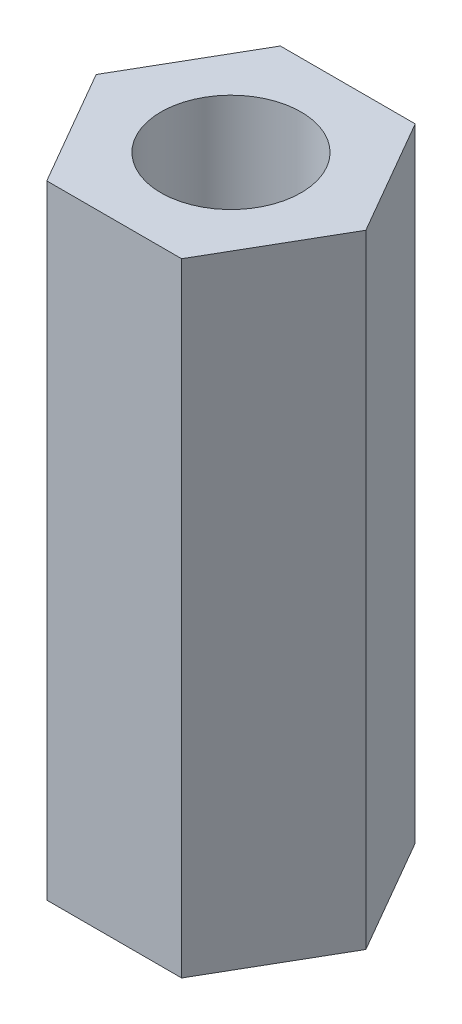
from build123d import *

# Parameters (mm, degrees)
BOSS_EXTRUDE1_DEPTH = 12
SKETCH2_R           = 1.35
CUT_EXTRUDE1_DEPTH  = 13.482487733


with BuildPart() as part:
    # Sketch1 → Boss-Extrude1 (new body)
    with BuildSketch(Plane(origin=(0, 0, 0), x_dir=(1, 0, 0), z_dir=(0, 1, 0))):
        Polygon((-1.299038106, -2.25), (1.299038106, -2.25), (2.598076211, 0), (1.299038106, 2.25), (-1.299038106, 2.25), (-2.598076211, 0), align=None)
    extrude(amount=BOSS_EXTRUDE1_DEPTH)

    # Sketch2 → Cut-Extrude1 (cut, through all)
    with BuildSketch(Plane(origin=(0, 12, 0), x_dir=(1, 0, 0), z_dir=(0, 1, 0))):
        with Locations(Location((0, 0, 0), (0, 0, 270))):
            Circle(SKETCH2_R)
    extrude(amount=-CUT_EXTRUDE1_DEPTH, mode=Mode.SUBTRACT)


solid = part.part
